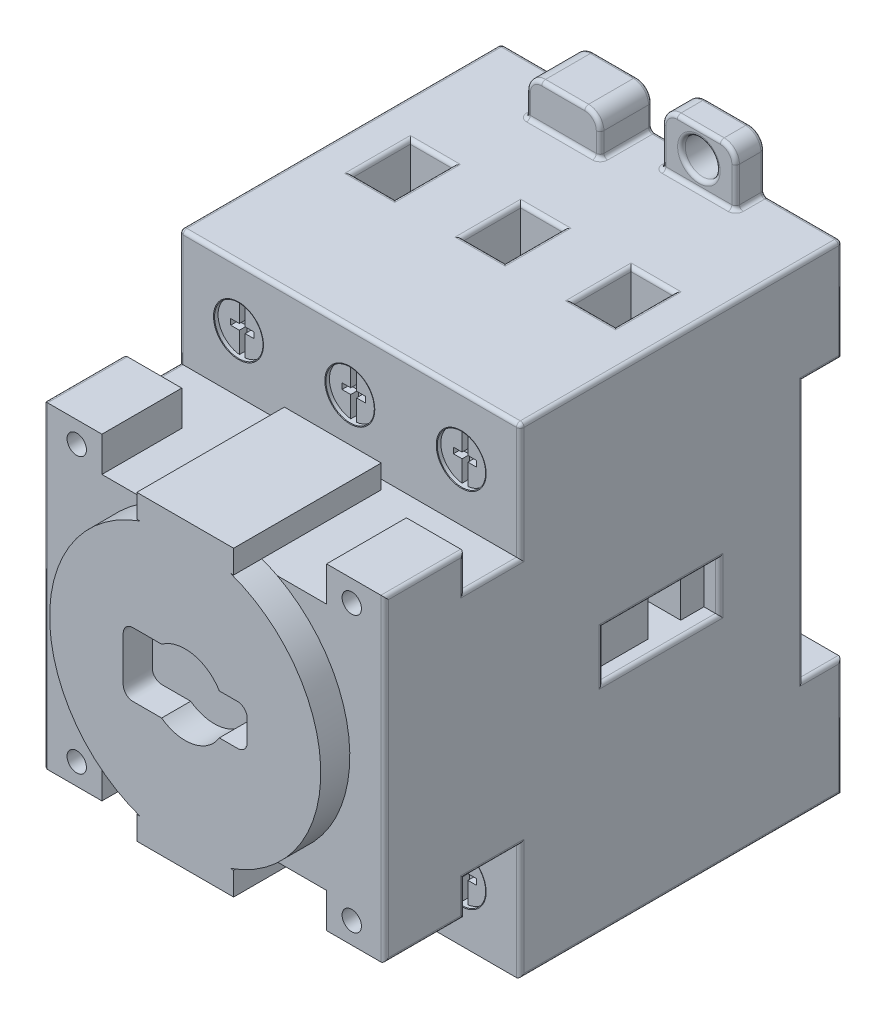
from build123d import *
from OCP.BRepFilletAPI import BRepFilletAPI_MakeChamfer

# Parameters (mm, degrees)
SKETCH1_W           = 44.704
SKETCH1_H           = 62.992
BOSS_EXTRUDE1_DEPTH = 60
SKETCH6_W           = 44.704
SKETCH6_H           = 34.036
CUT_EXTRUDE5_DEPTH  = 5.08
SKETCH3_W           = 44.704
SKETCH3_H           = 10.668
CUT_EXTRUDE2_DEPTH  = 17.78
SKETCH4_R           = 17.78
BOSS_EXTRUDE2_DEPTH = 3.81
SKETCH5_W           = 29.464
SKETCH5_H           = 4.572
SKETCH5_W_2         = 29.46
SKETCH5_H_2         = 4.57
CUT_EXTRUDE3_DEPTH  = 17.78
BOSS_EXTRUDE3_REACH = 76.588
SKETCH7_W           = 12.7
SKETCH7_H           = 3.048
SKETCH7_H_2         = 3.046
CUT_EXTRUDE6_REACH  = 87.493
SKETCH8_W           = 7.62
SKETCH8_H           = 7.31
SKETCH8_W_2         = 12.7
SKETCH8_H_2         = 2.23
CUT_EXTRUDE7_DEPTH  = 3.81
SKETCH10_W          = 9.652
SKETCH10_H          = 7.112
SKETCH10_H_2        = 5.08
BOSS_EXTRUDE4_DEPTH = 6.858
SKETCH11_W          = 9.652
SKETCH11_H          = 7.112
CUT_EXTRUDE8_DEPTH  = 3.048
SKETCH12_R          = 2.286
CUT_EXTRUDE9_DEPTH  = 78.85824093
CUT_EXTRUDE11_DEPTH = 1.5
SKETCH15_W          = 7.622
SKETCH15_H          = 7.31
SKETCH15_W_2        = 12.7
SKETCH15_H_2        = 2.03
CUT_EXTRUDE12_DEPTH = 4.57
CUT_EXTRUDE10_REACH = 76.768
SKETCH13_R          = 1.27
SKETCH16_W          = 5.588
SKETCH16_H          = 7.62
CUT_EXTRUDE13_DEPTH = 10
SKETCH17_W          = 5.588
SKETCH17_H          = 7.62
CUT_EXTRUDE14_DEPTH = 10
CUT_EXTRUDE15_DEPTH = 0.5
SKETCH21_W          = 15.24
SKETCH21_H          = 6.35
CUT_EXTRUDE16_DEPTH = 2
SKETCH22_W          = 15.24
SKETCH22_H          = 6.35
CUT_EXTRUDE17_DEPTH = 2
SKETCH24_W          = 4.318
SKETCH24_H          = 6.35
CUT_EXTRUDE18_DEPTH = 10
SKETCH25_W          = 4.318
SKETCH25_H          = 6.35
CUT_EXTRUDE19_DEPTH = 10
FILLET1_R           = 2
FILLET2_R           = 0.5
CHAMFER1_SIZE       = 0.1
CHAMFER1_SIZE2      = 0.036397023


with BuildPart() as part:
    # Sketch1 → Boss-Extrude1 (new body)
    with BuildSketch(Plane.XY):
        Rectangle(SKETCH1_W, SKETCH1_H)
    extrude(amount=BOSS_EXTRUDE1_DEPTH)

    # Sketch6 → Cut-Extrude5 (cut)
    with BuildSketch(Plane(origin=(0, 0, 0), x_dir=(-1, 0, 0), z_dir=(0, 0, -1))):
        with Locations((0, 1.016)):
            Rectangle(SKETCH6_W, SKETCH6_H)
    extrude(amount=-CUT_EXTRUDE5_DEPTH, mode=Mode.SUBTRACT)

    # Sketch3 → Cut-Extrude2 (cut)
    with BuildSketch(Plane.XY.offset(60)):
        with Locations((0, 26.162)):
            Rectangle(SKETCH3_W, SKETCH3_H)
        with Locations((0, -26.162)):
            Rectangle(SKETCH3_W, SKETCH3_H)
    extrude(amount=-CUT_EXTRUDE2_DEPTH, mode=Mode.SUBTRACT)

    # Sketch4 → Boss-Extrude2 (add)
    with BuildSketch(Plane.XY.offset(60)):
        with Locations(Location((0, 0.508, 0), (0, 0, 180))):
            Circle(SKETCH4_R)
    extrude(amount=BOSS_EXTRUDE2_DEPTH)

    # Sketch5 → Cut-Extrude3 (cut)
    with BuildSketch(Plane.XY.offset(60)):
        with Locations((0, 18.542)):
            Rectangle(SKETCH5_W, SKETCH5_H)
        with Locations((0, -18.543)):
            Rectangle(SKETCH5_W_2, SKETCH5_H_2)
    extrude(amount=-CUT_EXTRUDE3_DEPTH, mode=Mode.SUBTRACT)

    # Boss-Extrude3: up to this face of the body (flat: up to its plane)
    boss_extrude3_end = Plane(part.part.faces().sort_by_distance((0, 24.483670886, 42.22))[0])
    # Sketch7 → Boss-Extrude3 (add, up to the picked face)
    with BuildSketch(Plane.XY.offset(63.81), mode=Mode.PRIVATE) as boss_extrude3_sk1:
        with Locations((0, 18.796)):
            Rectangle(SKETCH7_W, SKETCH7_H)
    boss_extrude3_tool1 = split(extrude(boss_extrude3_sk1.sketch, amount=-BOSS_EXTRUDE3_REACH, mode=Mode.PRIVATE), bisect_by=boss_extrude3_end, keep=Keep.BOTH, mode=Mode.PRIVATE)
    # Sketch7 → Boss-Extrude3 (add, up to the picked face)
    with BuildSketch(Plane.XY.offset(63.81), mode=Mode.PRIVATE) as boss_extrude3_sk2:
        with Locations((0, -17.781)):
            Rectangle(SKETCH7_W, SKETCH7_H_2)
    boss_extrude3_tool2 = split(extrude(boss_extrude3_sk2.sketch, amount=-BOSS_EXTRUDE3_REACH, mode=Mode.PRIVATE), bisect_by=boss_extrude3_end, keep=Keep.BOTH, mode=Mode.PRIVATE)
    add(boss_extrude3_tool1.solids().sort_by(Axis((0, 18.796, 63.81), (0, 0, -1)))[0])
    add(boss_extrude3_tool2.solids().sort_by(Axis((0, -17.781, 63.81), (0, 0, -1)))[0])

    # Cut-Extrude6: up to this face of the body (flat: up to its plane)
    cut_extrude6_end = Plane(part.part.faces().sort_by_distance((0, 16.256, 51.11))[0])
    # Sketch8 → Cut-Extrude6 (cut, up to the picked face)
    with BuildSketch(Plane(origin=(0, 20.828, 0), x_dir=(1, 0, 0), z_dir=(0, 1, 0)), mode=Mode.PRIVATE) as cut_extrude6_sk1:
        with Locations((-18.542, -45.875)):
            Rectangle(SKETCH8_W, SKETCH8_H)
    cut_extrude6_tool1 = split(extrude(cut_extrude6_sk1.sketch, amount=-CUT_EXTRUDE6_REACH, mode=Mode.PRIVATE), bisect_by=cut_extrude6_end, keep=Keep.BOTH, mode=Mode.PRIVATE)
    # Sketch8 → Cut-Extrude6 (cut, up to the picked face)
    with BuildSketch(Plane(origin=(0, 20.828, 0), x_dir=(1, 0, 0), z_dir=(0, 1, 0)), mode=Mode.PRIVATE) as cut_extrude6_sk2:
        with Locations((18.542, -45.875)):
            Rectangle(SKETCH8_W, SKETCH8_H)
    cut_extrude6_tool2 = split(extrude(cut_extrude6_sk2.sketch, amount=-CUT_EXTRUDE6_REACH, mode=Mode.PRIVATE), bisect_by=cut_extrude6_end, keep=Keep.BOTH, mode=Mode.PRIVATE)
    # Sketch8 → Cut-Extrude6 (cut, up to the picked face)
    with BuildSketch(Plane(origin=(0, 20.828, 0), x_dir=(1, 0, 0), z_dir=(0, 1, 0)), mode=Mode.PRIVATE) as cut_extrude6_sk3:
        with Locations((0, -43.335)):
            Rectangle(SKETCH8_W_2, SKETCH8_H_2)
    cut_extrude6_tool3 = split(extrude(cut_extrude6_sk3.sketch, amount=-CUT_EXTRUDE6_REACH, mode=Mode.PRIVATE), bisect_by=cut_extrude6_end, keep=Keep.BOTH, mode=Mode.PRIVATE)
    add(cut_extrude6_tool1.solids().sort_by(Axis((-18.542, 20.828, 45.875), (0, -1, 0)))[0], mode=Mode.SUBTRACT)
    add(cut_extrude6_tool2.solids().sort_by(Axis((18.542, 20.828, 45.875), (0, -1, 0)))[0], mode=Mode.SUBTRACT)
    add(cut_extrude6_tool3.solids().sort_by(Axis((0, 20.828, 43.335), (0, -1, 0)))[0], mode=Mode.SUBTRACT)

    # Sketch9 → Cut-Extrude7 (cut)
    with BuildSketch(Plane.XY.offset(63.81)):
        with BuildLine():
            ThreePointArc((-3.090043365, -3.683), (1.028681628, -4.596376858), (4.472131483, -2.159))
            add(Edge.make_bspline(
                [(4.472131483, -2.159), (5.267420989, -2.159), (6.062710494, -2.159), (6.858, -2.159), (7.601948776, -2.159), (8.128, -1.632948776), (8.128, -0.889), (8.128, 0.042333333), (8.128, 0.973666667), (8.128, 1.905), (8.128, 2.648948776), (7.601948776, 3.175), (6.858, 3.175), (6.062710494, 3.175), (5.267420989, 3.175), (4.472131483, 3.175)],
                knots=[0, 0, 0, 0, 0.054776684, 0.054776684, 0.054776684, 0.096011869, 0.096011869, 0.096011869, 0.160158763, 0.160158763, 0.160158763, 0.201393948, 0.201393948, 0.201393948, 0.256170632, 0.256170632, 0.256170632, 0.256170632], degree=3, weights=[1, 1, 1, 1, 0.804737854, 0.804737854, 1, 1, 1, 1, 0.804737854, 0.804737854, 1, 1, 1, 1]))
            ThreePointArc((4.472131483, 3.175), (1.028681628, 5.612376858), (-3.090043365, 4.699))
            add(Edge.make_bspline(
                [(-3.090043365, 4.699), (-4.34602891, 4.699), (-5.602014455, 4.699), (-6.858, 4.699), (-7.601948776, 4.699), (-8.128, 4.172948776), (-8.128, 3.429), (-8.128, 1.481666667), (-8.128, -0.465666667), (-8.128, -2.413), (-8.128, -3.156948776), (-7.601948776, -3.683), (-6.858, -3.683), (-5.602014455, -3.683), (-4.34602891, -3.683), (-3.090043365, -3.683)],
                knots=[0.433279697, 0.433279697, 0.433279697, 0.433279697, 0.519787469, 0.519787469, 0.519787469, 0.561022654, 0.561022654, 0.561022654, 0.695147978, 0.695147978, 0.695147978, 0.736383163, 0.736383163, 0.736383163, 0.822890935, 0.822890935, 0.822890935, 0.822890935], degree=3, weights=[1, 1, 1, 1, 0.804737854, 0.804737854, 1, 1, 1, 1, 0.804737854, 0.804737854, 1, 1, 1, 1]))
        make_face()
    extrude(amount=-CUT_EXTRUDE7_DEPTH, mode=Mode.SUBTRACT)

    # Sketch10 → Boss-Extrude4 (add)
    with BuildSketch(Plane(origin=(0, 0, 0), x_dir=(-1, 0, 0), z_dir=(0, 0, -1))):
        with Locations((-7.366, 35.052)):
            Rectangle(SKETCH10_W, SKETCH10_H)
        with Locations((7.366, 34.036)):
            Rectangle(SKETCH10_W, SKETCH10_H_2)
        with Locations((7.874, -35.052)):
            Rectangle(SKETCH10_W, SKETCH10_H)
    extrude(amount=-BOSS_EXTRUDE4_DEPTH)

    # Sketch11 → Cut-Extrude8 (cut)
    with BuildSketch(Plane.XY.offset(6.858)):
        with Locations((7.366, 35.052)):
            Rectangle(SKETCH11_W, SKETCH11_H)
        with Locations((-7.874, -35.052)):
            Rectangle(SKETCH11_W, SKETCH11_H)
    extrude(amount=-CUT_EXTRUDE8_DEPTH, mode=Mode.SUBTRACT)

    # Sketch12 → Cut-Extrude9 (cut, through all)
    with BuildSketch(Plane(origin=(0, 0, 0), x_dir=(-1, 0, 0), z_dir=(0, 0, -1))):
        with Locations((-7.366, 35.052)):
            Circle(SKETCH12_R)
        with Locations((7.874, -35.052)):
            Circle(SKETCH12_R)
    extrude(amount=-CUT_EXTRUDE9_DEPTH, mode=Mode.SUBTRACT)

    # Sketch14 → Cut-Extrude11 (cut)
    with BuildSketch(Plane.XY.offset(42.22)):
        with BuildLine():
            Line((-14.224, 20.596942894), (-14.224, 23.368))
            Line((-14.224, 23.368), (-13.081, 23.368))
            Line((-13.081, 23.368), (-13.081, 24.13))
            Line((-13.081, 24.13), (-14.224, 24.13))
            Line((-14.224, 24.13), (-14.224, 26.901057106))
            ThreePointArc((-14.224, 26.901057106), (-14.605, 26.924), (-14.986, 26.901057106))
            Line((-14.986, 26.901057106), (-14.986, 24.13))
            Line((-14.986, 24.13), (-16.129, 24.13))
            Line((-16.129, 24.13), (-16.129, 23.368))
            Line((-16.129, 23.368), (-14.986, 23.368))
            Line((-14.986, 23.368), (-14.986, 20.596942894))
            ThreePointArc((-14.986, 20.596942894), (-14.605, 20.574), (-14.224, 20.596942894))
        make_face()
        with BuildLine():
            Line((0.381, 20.596942894), (0.381, 23.368))
            Line((0.381, 23.368), (1.524, 23.368))
            Line((1.524, 23.368), (1.524, 24.13))
            Line((1.524, 24.13), (0.381, 24.13))
            Line((0.381, 24.13), (0.381, 26.901057106))
            ThreePointArc((0.381, 26.901057106), (0, 26.924), (-0.381, 26.901057106))
            Line((-0.381, 26.901057106), (-0.381, 24.13))
            Line((-0.381, 24.13), (-1.524, 24.13))
            Line((-1.524, 24.13), (-1.524, 23.368))
            Line((-1.524, 23.368), (-0.381, 23.368))
            Line((-0.381, 23.368), (-0.381, 20.596942894))
            ThreePointArc((-0.381, 20.596942894), (0, 20.574), (0.381, 20.596942894))
        make_face()
        with BuildLine():
            Line((16.129, 24.13), (14.986, 24.13))
            Line((14.986, 24.13), (14.986, 26.901057106))
            ThreePointArc((14.986, 26.901057106), (14.605, 26.924), (14.224, 26.901057106))
            Line((14.224, 26.901057106), (14.224, 24.13))
            Line((14.224, 24.13), (13.081, 24.13))
            Line((13.081, 24.13), (13.081, 23.368))
            Line((13.081, 23.368), (14.224, 23.368))
            Line((14.224, 23.368), (14.224, 20.596942894))
            ThreePointArc((14.224, 20.596942894), (14.605, 20.574), (14.986, 20.596942894))
            Line((14.986, 20.596942894), (14.986, 23.368))
            Line((14.986, 23.368), (16.129, 23.368))
            Line((16.129, 23.368), (16.129, 24.13))
        make_face()
        with BuildLine():
            Line((14.986, -23.368), (14.986, -20.828))
            Line((14.986, -20.828), (14.73, -20.828))
            Line((14.73, -20.828), (14.73, -20.576461584))
            ThreePointArc((14.73, -20.576461584), (14.476591001, -20.576597735), (14.224, -20.596942894))
            Line((14.224, -20.596942894), (14.224, -23.368))
            Line((14.224, -23.368), (13.081, -23.368))
            Line((13.081, -23.368), (13.081, -24.13))
            Line((13.081, -24.13), (14.224, -24.13))
            Line((14.224, -24.13), (14.224, -26.901057106))
            ThreePointArc((14.224, -26.901057106), (14.605, -26.924), (14.986, -26.901057106))
            Line((14.986, -26.901057106), (14.986, -24.13))
            Line((14.986, -24.13), (16.129, -24.13))
            Line((16.129, -24.13), (16.129, -23.368))
            Line((16.129, -23.368), (14.986, -23.368))
        make_face()
        with BuildLine():
            Line((1.524, -23.368), (0.381, -23.368))
            Line((0.381, -23.368), (0.381, -20.596942894))
            ThreePointArc((0.381, -20.596942894), (0, -20.574), (-0.381, -20.596942894))
            Line((-0.381, -20.596942894), (-0.381, -23.368))
            Line((-0.381, -23.368), (-1.524, -23.368))
            Line((-1.524, -23.368), (-1.524, -24.13))
            Line((-1.524, -24.13), (-0.381, -24.13))
            Line((-0.381, -24.13), (-0.381, -26.901057106))
            ThreePointArc((-0.381, -26.901057106), (0, -26.924), (0.381, -26.901057106))
            Line((0.381, -26.901057106), (0.381, -24.13))
            Line((0.381, -24.13), (1.524, -24.13))
            Line((1.524, -24.13), (1.524, -23.368))
        make_face()
        with BuildLine():
            Line((-13.081, -23.368), (-14.224, -23.368))
            Line((-14.224, -23.368), (-14.224, -20.596942894))
            ThreePointArc((-14.224, -20.596942894), (-14.476591001, -20.576597735), (-14.73, -20.576461584))
            Line((-14.73, -20.576461584), (-14.73, -20.828))
            Line((-14.73, -20.828), (-14.986, -20.828))
            Line((-14.986, -20.828), (-14.986, -23.368))
            Line((-14.986, -23.368), (-16.129, -23.368))
            Line((-16.129, -23.368), (-16.129, -24.13))
            Line((-16.129, -24.13), (-14.986, -24.13))
            Line((-14.986, -24.13), (-14.986, -26.901057106))
            ThreePointArc((-14.986, -26.901057106), (-14.605, -26.924), (-14.224, -26.901057106))
            Line((-14.224, -26.901057106), (-14.224, -24.13))
            Line((-14.224, -24.13), (-13.081, -24.13))
            Line((-13.081, -24.13), (-13.081, -23.368))
        make_face()
    extrude(amount=-CUT_EXTRUDE11_DEPTH, mode=Mode.SUBTRACT)

    # Sketch15 → Cut-Extrude12 (cut)
    with BuildSketch(Plane.XZ.offset(20.828)):
        with Locations((18.541, 45.875)):
            Rectangle(SKETCH15_W, SKETCH15_H)
        with Locations((-18.541, 45.875)):
            Rectangle(SKETCH15_W, SKETCH15_H)
        with Locations((0, 43.235)):
            Rectangle(SKETCH15_W_2, SKETCH15_H_2)
    extrude(amount=-CUT_EXTRUDE12_DEPTH, mode=Mode.SUBTRACT)

    # Sketch13 → Cut-Extrude10 (cut, up to next)
    with BuildSketch(Plane.XY.offset(60), mode=Mode.PRIVATE) as cut_extrude10_sk1:
        with Locations((-18.034, 18.034)):
            Circle(SKETCH13_R)
    cut_extrude10_tool1 = extrude(cut_extrude10_sk1.sketch, amount=-CUT_EXTRUDE10_REACH, mode=Mode.PRIVATE) & part.part
    # Sketch13 → Cut-Extrude10 (cut, up to next)
    with BuildSketch(Plane.XY.offset(60), mode=Mode.PRIVATE) as cut_extrude10_sk2:
        with Locations((18.034, 18.034)):
            Circle(SKETCH13_R)
    cut_extrude10_tool2 = extrude(cut_extrude10_sk2.sketch, amount=-CUT_EXTRUDE10_REACH, mode=Mode.PRIVATE) & part.part
    # Sketch13 → Cut-Extrude10 (cut, up to next)
    with BuildSketch(Plane.XY.offset(60), mode=Mode.PRIVATE) as cut_extrude10_sk3:
        with Locations((18.034, -18.034)):
            Circle(SKETCH13_R)
    cut_extrude10_tool3 = extrude(cut_extrude10_sk3.sketch, amount=-CUT_EXTRUDE10_REACH, mode=Mode.PRIVATE) & part.part
    # Sketch13 → Cut-Extrude10 (cut, up to next)
    with BuildSketch(Plane.XY.offset(60), mode=Mode.PRIVATE) as cut_extrude10_sk4:
        with Locations((-18.034, -18.034)):
            Circle(SKETCH13_R)
    cut_extrude10_tool4 = extrude(cut_extrude10_sk4.sketch, amount=-CUT_EXTRUDE10_REACH, mode=Mode.PRIVATE) & part.part
    add(cut_extrude10_tool1.solids().sort_by_distance((-18.034, 18.034, 60))[0], mode=Mode.SUBTRACT)
    add(cut_extrude10_tool2.solids().sort_by_distance((18.034, 18.034, 60))[0], mode=Mode.SUBTRACT)
    add(cut_extrude10_tool3.solids().sort_by_distance((18.034, -18.034, 60))[0], mode=Mode.SUBTRACT)
    add(cut_extrude10_tool4.solids().sort_by_distance((-18.034, -18.034, 60))[0], mode=Mode.SUBTRACT)

    # Sketch16 → Cut-Extrude13 (cut)
    with BuildSketch(Plane.XZ.offset(31.496)):
        with Locations((14.478, 20.828)):
            Rectangle(SKETCH16_W, SKETCH16_H)
        with Locations((0, 20.828)):
            Rectangle(SKETCH16_W, SKETCH16_H)
        with Locations((-14.478, 20.828)):
            Rectangle(SKETCH16_W, SKETCH16_H)
    extrude(amount=-CUT_EXTRUDE13_DEPTH, mode=Mode.SUBTRACT)

    # Sketch17 → Cut-Extrude14 (cut)
    with BuildSketch(Plane(origin=(0, 31.496, 0), x_dir=(1, 0, 0), z_dir=(0, 1, 0))):
        with Locations((-14.478, -20.828)):
            Rectangle(SKETCH17_W, SKETCH17_H)
        with Locations((0, -20.828)):
            Rectangle(SKETCH17_W, SKETCH17_H)
        with Locations((14.478, -20.828)):
            Rectangle(SKETCH17_W, SKETCH17_H)
    extrude(amount=-CUT_EXTRUDE14_DEPTH, mode=Mode.SUBTRACT)

    # Sketch20 → Cut-Extrude15 (cut)
    with BuildSketch(Plane.XY.offset(42.22)):
        with BuildLine():
            ThreePointArc((-17.78, 23.749), (-16.980952441, 21.642943258), (-14.986, 20.596942894))
            Line((-14.986, 20.596942894), (-14.986, 23.368))
            Line((-14.986, 23.368), (-16.129, 23.368))
            Line((-16.129, 23.368), (-16.129, 24.13))
            Line((-16.129, 24.13), (-14.986, 24.13))
            Line((-14.986, 24.13), (-14.986, 26.901057106))
            ThreePointArc((-14.986, 26.901057106), (-16.980952441, 25.855056742), (-17.78, 23.749))
        make_face()
        with BuildLine():
            Line((-13.081, 23.368), (-14.224, 23.368))
            Line((-14.224, 23.368), (-14.224, 20.596942894))
            ThreePointArc((-14.224, 20.596942894), (-12.229047559, 21.642943258), (-11.43, 23.749))
            ThreePointArc((-11.43, 23.749), (-12.229047559, 25.855056742), (-14.224, 26.901057106))
            Line((-14.224, 26.901057106), (-14.224, 24.13))
            Line((-14.224, 24.13), (-13.081, 24.13))
            Line((-13.081, 24.13), (-13.081, 23.368))
        make_face()
        with BuildLine():
            ThreePointArc((-3.175, 23.749), (-2.375952441, 21.642943258), (-0.381, 20.596942894))
            Line((-0.381, 20.596942894), (-0.381, 23.368))
            Line((-0.381, 23.368), (-1.524, 23.368))
            Line((-1.524, 23.368), (-1.524, 24.13))
            Line((-1.524, 24.13), (-0.381, 24.13))
            Line((-0.381, 24.13), (-0.381, 26.901057106))
            ThreePointArc((-0.381, 26.901057106), (-2.375952441, 25.855056742), (-3.175, 23.749))
        make_face()
        with BuildLine():
            Line((1.524, 23.368), (0.381, 23.368))
            Line((0.381, 23.368), (0.381, 20.596942894))
            ThreePointArc((0.381, 20.596942894), (2.375952441, 21.642943258), (3.175, 23.749))
            ThreePointArc((3.175, 23.749), (2.375952441, 25.855056742), (0.381, 26.901057106))
            Line((0.381, 26.901057106), (0.381, 24.13))
            Line((0.381, 24.13), (1.524, 24.13))
            Line((1.524, 24.13), (1.524, 23.368))
        make_face()
        with BuildLine():
            Line((14.224, 24.13), (14.224, 26.901057106))
            ThreePointArc((14.224, 26.901057106), (12.229047559, 25.855056742), (11.43, 23.749))
            ThreePointArc((11.43, 23.749), (12.229047559, 21.642943258), (14.224, 20.596942894))
            Line((14.224, 20.596942894), (14.224, 23.368))
            Line((14.224, 23.368), (13.081, 23.368))
            Line((13.081, 23.368), (13.081, 24.13))
            Line((13.081, 24.13), (14.224, 24.13))
        make_face()
        with BuildLine():
            Line((14.986, 26.901057106), (14.986, 24.13))
            Line((14.986, 24.13), (16.129, 24.13))
            Line((16.129, 24.13), (16.129, 23.368))
            Line((16.129, 23.368), (14.986, 23.368))
            Line((14.986, 23.368), (14.986, 20.596942894))
            ThreePointArc((14.986, 20.596942894), (16.980952441, 21.642943258), (17.78, 23.749))
            ThreePointArc((17.78, 23.749), (16.980952441, 25.855056742), (14.986, 26.901057106))
        make_face()
        with BuildLine():
            Line((16.129, -24.13), (14.986, -24.13))
            Line((14.986, -24.13), (14.986, -26.901057106))
            ThreePointArc((14.986, -26.901057106), (16.980952441, -25.855056742), (17.78, -23.749))
            ThreePointArc((17.78, -23.749), (16.980952441, -21.642943258), (14.986, -20.596942894))
            Line((14.986, -20.596942894), (14.986, -23.368))
            Line((14.986, -23.368), (16.129, -23.368))
            Line((16.129, -23.368), (16.129, -24.13))
        make_face()
        with BuildLine():
            ThreePointArc((11.43, -23.749), (12.229047559, -25.855056742), (14.224, -26.901057106))
            Line((14.224, -26.901057106), (14.224, -24.13))
            Line((14.224, -24.13), (13.081, -24.13))
            Line((13.081, -24.13), (13.081, -23.368))
            Line((13.081, -23.368), (14.224, -23.368))
            Line((14.224, -23.368), (14.224, -20.596942894))
            ThreePointArc((14.224, -20.596942894), (12.229047559, -21.642943258), (11.43, -23.749))
        make_face()
        with BuildLine():
            Line((0.381, -20.596942894), (0.381, -23.368))
            Line((0.381, -23.368), (1.524, -23.368))
            Line((1.524, -23.368), (1.524, -24.13))
            Line((1.524, -24.13), (0.381, -24.13))
            Line((0.381, -24.13), (0.381, -26.901057106))
            ThreePointArc((0.381, -26.901057106), (2.375952441, -25.855056742), (3.175, -23.749))
            ThreePointArc((3.175, -23.749), (2.375952441, -21.642943258), (0.381, -20.596942894))
        make_face()
        with BuildLine():
            Line((-0.381, -23.368), (-0.381, -20.596942894))
            ThreePointArc((-0.381, -20.596942894), (-2.375952441, -21.642943258), (-3.175, -23.749))
            ThreePointArc((-3.175, -23.749), (-2.375952441, -25.855056742), (-0.381, -26.901057106))
            Line((-0.381, -26.901057106), (-0.381, -24.13))
            Line((-0.381, -24.13), (-1.524, -24.13))
            Line((-1.524, -24.13), (-1.524, -23.368))
            Line((-1.524, -23.368), (-0.381, -23.368))
        make_face()
        with BuildLine():
            Line((-14.224, -20.596942894), (-14.224, -23.368))
            Line((-14.224, -23.368), (-13.081, -23.368))
            Line((-13.081, -23.368), (-13.081, -24.13))
            Line((-13.081, -24.13), (-14.224, -24.13))
            Line((-14.224, -24.13), (-14.224, -26.901057106))
            ThreePointArc((-14.224, -26.901057106), (-12.229047559, -25.855056742), (-11.43, -23.749))
            ThreePointArc((-11.43, -23.749), (-12.229047559, -21.642943258), (-14.224, -20.596942894))
        make_face()
        with BuildLine():
            Line((-14.986, -23.368), (-14.986, -20.596942894))
            ThreePointArc((-14.986, -20.596942894), (-16.980952441, -21.642943258), (-17.78, -23.749))
            ThreePointArc((-17.78, -23.749), (-16.980952441, -25.855056742), (-14.986, -26.901057106))
            Line((-14.986, -26.901057106), (-14.986, -24.13))
            Line((-14.986, -24.13), (-16.129, -24.13))
            Line((-16.129, -24.13), (-16.129, -23.368))
            Line((-16.129, -23.368), (-14.986, -23.368))
        make_face()
    extrude(amount=-CUT_EXTRUDE15_DEPTH, mode=Mode.SUBTRACT)

    # Sketch21 → Cut-Extrude16 (cut)
    with BuildSketch(Plane.ZY.offset(22.352)):
        with Locations((23.749, 0)):
            Rectangle(SKETCH21_W, SKETCH21_H)
    extrude(amount=-CUT_EXTRUDE16_DEPTH, mode=Mode.SUBTRACT)

    # Sketch22 → Cut-Extrude17 (cut)
    with BuildSketch(Plane(origin=(22.352, 0, 0), x_dir=(0, 0, -1), z_dir=(1, 0, 0))):
        with Locations((-23.749, 0)):
            Rectangle(SKETCH22_W, SKETCH22_H)
    extrude(amount=-CUT_EXTRUDE17_DEPTH, mode=Mode.SUBTRACT)

    # Sketch24 → Cut-Extrude18 (cut)
    with BuildSketch(Plane.ZY.offset(22.352)):
        with Locations((21.336, 0)):
            Rectangle(SKETCH24_W, SKETCH24_H)
    extrude(amount=-CUT_EXTRUDE18_DEPTH, mode=Mode.SUBTRACT)

    # Sketch25 → Cut-Extrude19 (cut)
    with BuildSketch(Plane(origin=(22.352, 0, 0), x_dir=(0, 0, -1), z_dir=(1, 0, 0))):
        with Locations((-21.336, 0)):
            Rectangle(SKETCH25_W, SKETCH25_H)
    extrude(amount=-CUT_EXTRUDE19_DEPTH, mode=Mode.SUBTRACT)

    # Fillet1
    fillet1_edges = [part.edges().sort_by_distance(p)[0] for p in [
        (-12.7, -38.608, 1.905),
        (-3.048, -38.608, 1.905),
        (-12.192, 36.576, 3.429),
        (-2.54, 36.576, 3.429),
        (2.54, 38.608, 1.905),
        (12.192, 38.608, 1.905),
    ]]
    fillet(fillet1_edges, radius=FILLET1_R)

    # Fillet2
    fillet2_edges = [part.edges().sort_by_distance(p)[0] for p in [
        (-7.366, 36.576, 0),
        (-7.366, 36.576, 6.858),
        (7.366, 38.608, 0),
        (7.366, 38.608, 3.81),
        (11.606213562, 38.022213562, 0),
        (-11.606213562, 35.990213562, 0),
        (-3.125786438, 35.990213562, 0),
        (3.125786438, 38.022213562, 0),
        (12.192, 34.052, 0),
        (12.192, 34.052, 3.81),
        (-12.192, 33.036, 6.858),
        (-12.192, 33.036, 0),
        (-2.54, 33.036, 0),
        (-2.54, 33.036, 6.858),
        (2.54, 34.052, 3.81),
        (2.54, 34.052, 0),
        (-22.352, -31.496, 21.11),
        (-22.352, -23.749, 0),
        (-22.352, -16.002, 2.54),
        (-22.352, 1.016, 5.08),
        (-22.352, 18.034, 2.54),
        (-22.352, 24.765, 0),
        (-22.352, 23.876, 42.22),
        (-22.352, 16.256, 45.875),
        (-22.352, 18.542, 49.53),
        (-22.352, 20.828, 54.765),
        (-22.352, 0, 60),
        (-22.352, -20.828, 54.765),
        (-22.352, -18.543, 49.53),
        (-22.352, -16.258, 45.875),
        (-22.352, -23.877, 42.22),
        (-22.352, 0, 31.369),
        (-22.352, 3.175, 23.749),
        (-22.352, 0, 16.129),
        (-22.352, -3.175, 23.749),
        (22.352, 0, 60),
        (22.352, 20.828, 54.765),
        (22.352, 18.542, 49.53),
        (22.352, 16.256, 45.875),
        (22.352, 23.876, 42.22),
        (22.352, 24.765, 0),
        (22.352, 18.034, 2.54),
        (22.352, 1.016, 5.08),
        (22.352, -16.002, 2.54),
        (22.352, -23.749, 0),
        (22.352, -31.496, 21.11),
        (22.352, -23.877, 42.22),
        (22.352, -16.258, 45.875),
        (22.352, -18.543, 49.53),
        (22.352, -20.828, 54.765),
        (22.352, 0, 16.129),
        (22.352, 3.175, 23.749),
        (22.352, 0, 31.369),
        (22.352, -3.175, 23.749),
        (17.272, 31.496, 0),
        (22.352, 31.496, 21.11),
        (0, 31.496, 42.22),
        (-22.352, 31.496, 21.11),
        (-17.272, 31.496, 0),
        (-12.192, 31.496, 3.429),
        (-7.366, 31.496, 6.858),
        (-2.54, 31.496, 3.429),
        (0, 31.496, 0),
        (2.54, 31.496, 1.905),
        (7.366, 31.496, 3.81),
        (12.192, 31.496, 1.905),
        (-17.272, 31.496, 20.828),
        (-14.478, 31.496, 24.638),
        (-11.684, 31.496, 20.828),
        (-14.478, 31.496, 17.018),
        (-2.794, 31.496, 20.828),
        (0, 31.496, 24.638),
        (2.794, 31.496, 20.828),
        (0, 31.496, 17.018),
        (11.684, 31.496, 20.828),
        (14.478, 31.496, 24.638),
        (17.272, 31.496, 20.828),
        (14.478, 31.496, 17.018),
        (-3.048, -31.496, 1.905),
        (-12.7, -31.496, 1.905),
        (-7.874, -31.496, 3.81),
        (-3.048, -34.052, 3.81),
        (-3.633786438, -38.022213562, 3.81),
        (-7.874, -38.608, 3.81),
        (-12.114213562, -38.022213562, 3.81),
        (-12.7, -34.052, 3.81),
        (-5.588, -35.052, 3.81),
        (11.606213562, 38.022213562, 3.81),
        (3.125786438, 38.022213562, 3.81),
        (9.652, 35.052, 3.81),
        (-3.125786438, 35.990213562, 6.858),
        (-11.606213562, 35.990213562, 6.858),
    ]]
    fillet(fillet2_edges, radius=FILLET2_R)

    # Chamfer1: one chamfer whose edges measure the first distance from different faces: ONE call of the kernel's chamfer builder (chamfer() names one face for all edges)
    chamfer1_edges_1 = [part.edges().sort_by_distance(p)[0] for p in [
        (-14.986, 26.901057106, 42.22),
        (0.381, 26.901057106, 42.22),
        (14.224, 26.901057106, 42.22),
    ]]
    chamfer1_side_1 = [part.faces().sort_by_distance(p)[0] for p in [
        (0, 16.717227408, 42.22),
    ]]
    chamfer1_edges_2 = [part.edges().sort_by_distance(p)[0] for p in [
        (11.432597735, -23.877408999, 42.22),
        (-0.381, -26.901057106, 42.22),
        (-14.605, -26.924, 42.22),
    ]]
    chamfer1_side_2 = [part.faces().sort_by_distance(p)[0] for p in [
        (0, -31.033157018, 42.22),
    ]]
    chamfer1 = BRepFilletAPI_MakeChamfer(part.part.solid().wrapped)
    for e in chamfer1_edges_1:
        chamfer1.Add(CHAMFER1_SIZE, CHAMFER1_SIZE2, e.wrapped, chamfer1_side_1[0].wrapped)  # the first distance lies on this face
    for e in chamfer1_edges_2:
        chamfer1.Add(CHAMFER1_SIZE, CHAMFER1_SIZE2, e.wrapped, chamfer1_side_2[0].wrapped)  # the first distance lies on this face
    add(Compound.cast(chamfer1.Shape()), mode=Mode.REPLACE)


solid = part.part
